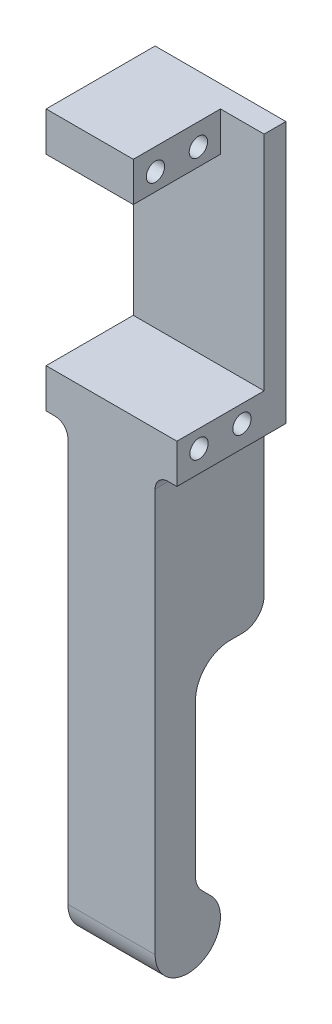
from build123d import *

# Parameters (mm, degrees)
EXTRUDE_1_DEPTH     = 25
CUT_EXTRUDE_1_DEPTH = 20
SKETCH_3_R          = 2.1
CUT_EXTRUDE_2_DEPTH = 139.614573548
CUT_EXTRUDE_4_DEPTH = 138.61903938


with BuildPart() as part:
    # 草图1 → 凸台-拉伸1 (new body)
    with BuildSketch(Plane.XY):
        with BuildLine():
            Line((-15, -30), (-13, -30))
            ThreePointArc((-13, -30), (-10.878679656, -30.878679656), (-10, -33))
            Line((-10, -33), (-10, -133))
            Line((-10, -133), (0, -133))
            Line((0, -133), (10, -133))
            Line((10, -133), (10, -61))
            Line((10, -61), (10, -33))
            ThreePointArc((10, -33), (10.878679656, -30.878679656), (13, -30))
            Line((13, -30), (15, -30))
            Line((15, -30), (15, 30))
            Line((15, 30), (-15, 30))
            Line((-15, 30), (-15, -30))
        make_face()
    extrude(amount=EXTRUDE_1_DEPTH)

    # 草图2 → 切除-拉伸1 (cut)
    with BuildSketch(Plane.XY.offset(25)):
        Polygon((-15, -21), (15, -21), (15, 30), (5, 30), (5, 21), (-15, 21), align=None)
    extrude(amount=-CUT_EXTRUDE_1_DEPTH, mode=Mode.SUBTRACT)

    # 草图3 → 切除-拉伸2 (cut, through all)
    with BuildSketch(Plane.ZY.offset(15)):
        with Locations(Location((10.075, 25, 0), (0, 0, 270))):
            Circle(SKETCH_3_R)
        with Locations(Location((19.925, 25, 0), (0, 0, 270))):
            Circle(SKETCH_3_R)
        with Locations(Location((19.925, -25, 0), (0, 0, 90))):
            Circle(SKETCH_3_R)
        with Locations(Location((10.075, -25, 0), (0, 0, 90))):
            Circle(SKETCH_3_R)
    extrude(amount=-CUT_EXTRUDE_2_DEPTH, mode=Mode.SUBTRACT)

    # 草图5 → 切除-拉伸4 (cut, through all)
    with BuildSketch(Plane.ZY.offset(10)):
        with BuildLine():
            Line((12.196699141, -120.196699141), (14.267766953, -118.125631329))
            ThreePointArc((14.267766953, -118.125631329), (15.35163071, -116.503514585), (15.732233047, -114.590097423))
            Line((15.732233047, -114.590097423), (15.732233047, -79.661165235))
            ThreePointArc((15.732233047, -79.661165235), (13.389087297, -74.004310986), (7.732233047, -71.661165235))
            Line((7.732233047, -71.661165235), (5, -71.661165235))
            ThreePointArc((5, -71.661165235), (1.464466094, -70.196699141), (0, -66.661165235))
            Line((0, -66.661165235), (0, -143.423968406))
            Line((0, -143.423968406), (25, -142.592205506))
            Line((25, -142.592205506), (25, -125.5))
            ThreePointArc((25, -125.5), (14.629874257, -132.429096494), (12.196699141, -120.196699141))
        make_face()
    extrude(amount=-CUT_EXTRUDE_4_DEPTH, mode=Mode.SUBTRACT)


solid = part.part
